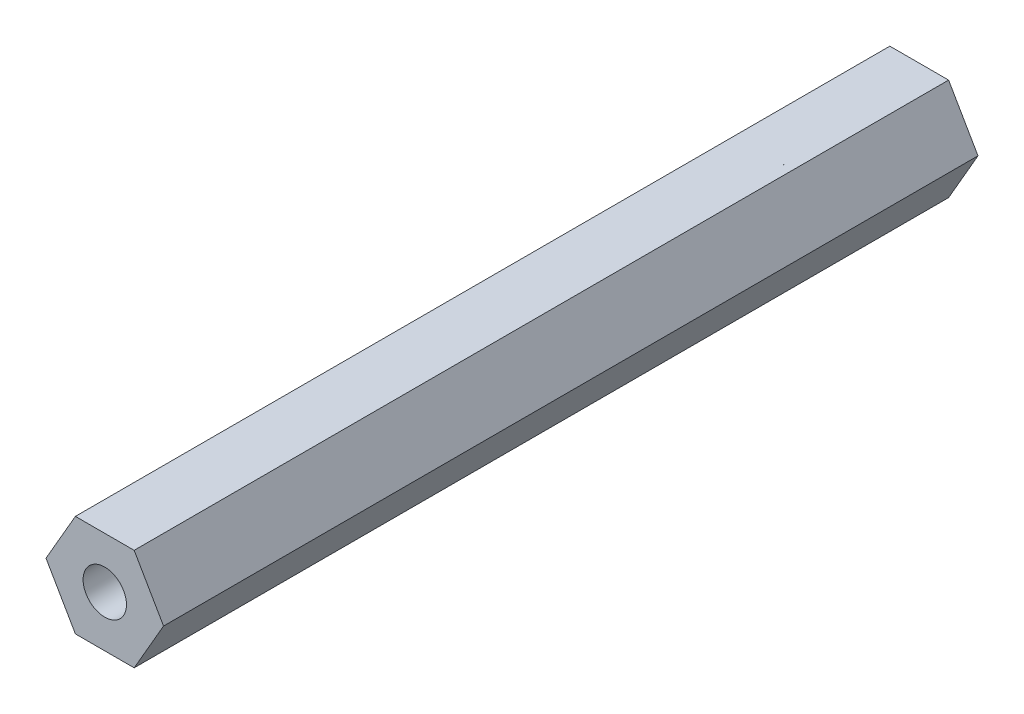
from build123d import *

# Parameters (mm, degrees)
BOSS_EXTRUDE1_DEPTH         = 50.8
F_1_4_28_TAPPED_HOLE1_D     = 5.4102
F_1_4_28_TAPPED_HOLE1_DEPTH = 57.15
F_1_4_28_TAPPED_HOLE1_TIP   = 1.625388061
F_1_4_28_TAPPED_HOLE2_D     = 5.4102
F_1_4_28_TAPPED_HOLE2_DEPTH = 57.15
F_1_4_28_TAPPED_HOLE2_TIP   = 1.625388061


with BuildPart() as part:
    # Sketch1 → Boss-Extrude1 (new, symmetric)
    with BuildSketch(Plane.XY):
        Polygon((7.332348419, 0), (3.666174209, 6.35), (-3.666174209, 6.35), (-7.332348419, 0), (-3.666174209, -6.35), (3.666174209, -6.35), align=None)
    extrude(amount=BOSS_EXTRUDE1_DEPTH, both=True)

    # 1/4-28 Tapped Hole1
    with Locations(Plane.XY.offset(50.8)):
        with Locations((0, 0)):
            Hole(F_1_4_28_TAPPED_HOLE1_D / 2, depth=F_1_4_28_TAPPED_HOLE1_DEPTH)
            with Locations((0, 0, -(F_1_4_28_TAPPED_HOLE1_DEPTH + F_1_4_28_TAPPED_HOLE1_TIP / 2))):  # 118° drill point
                Cone(0, F_1_4_28_TAPPED_HOLE1_D / 2, F_1_4_28_TAPPED_HOLE1_TIP, mode=Mode.SUBTRACT)

    # 1/4-28 Tapped Hole2
    with Locations(Plane(origin=(0, 0, -50.8), x_dir=(-1, 0, 0), z_dir=(0, 0, -1))):
        with Locations((0, 0)):
            Hole(F_1_4_28_TAPPED_HOLE2_D / 2, depth=F_1_4_28_TAPPED_HOLE2_DEPTH)
            with Locations((0, 0, -(F_1_4_28_TAPPED_HOLE2_DEPTH + F_1_4_28_TAPPED_HOLE2_TIP / 2))):  # 118° drill point
                Cone(0, F_1_4_28_TAPPED_HOLE2_D / 2, F_1_4_28_TAPPED_HOLE2_TIP, mode=Mode.SUBTRACT)


solid = part.part
